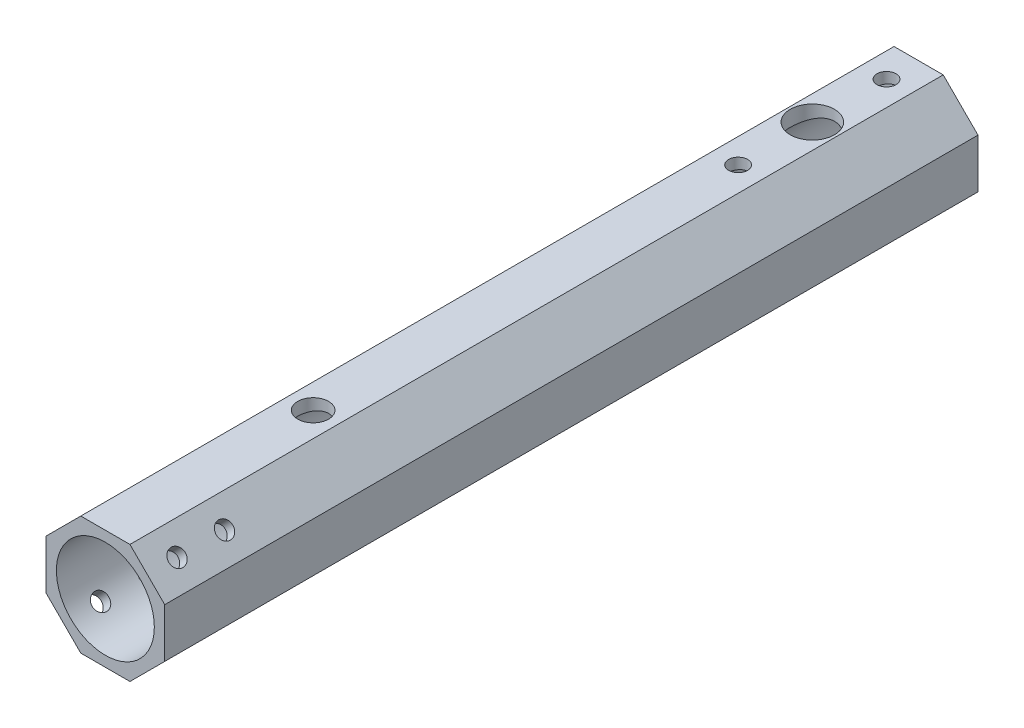
from build123d import *

# Parameters (mm, degrees)
SKETCH1_R               = 8.25
BOSS_EXTRUDE1_DEPTH     = 135
BOSS_EXTRUDE2_DEPTH     = 2
CUT_EXTRUDE1_DEPTH      = 138.727992797
CUT_EXTRUDE1_DEPTH_BACK = 138.727992797
SKETCH4_R               = 1.6
SKETCH4_R_2             = 2.6
SKETCH4_R_3             = 3.727922061
SKETCH6_R               = 1.4
CUT_EXTRUDE2_DEPTH      = 140.11090078
CIRPATTERN1_COUNT       = 2
CIRPATTERN1_ANGLE       = 270
SKETCH7_R               = 6.269832862
CUT_EXTRUDE3_DEPTH      = 138.727992904


with BuildPart() as part:
    # Sketch1 → Boss-Extrude1 (new body)
    with BuildSketch(Plane.XY):
        Polygon((10, 4.142135624), (4.142135624, 10), (-4.142135624, 10), (-10, 4.142135624), (-10, -4.142135624), (-4.142135624, -10), (4.142135624, -10), (10, -4.142135624), align=None)
        Circle(SKETCH1_R, mode=Mode.SUBTRACT)
    extrude(amount=-BOSS_EXTRUDE1_DEPTH)

    # Sketch2 → Boss-Extrude2 (add)
    with BuildSketch(Plane(origin=(0, 0, -135), x_dir=(-1, 0, 0), z_dir=(0, 0, -1))):
        Polygon((-10, 4.142135624), (-10, -4.142135624), (-4.142135624, -10), (4.142135624, -10), (10, -4.142135624), (10, 4.142135624), (4.142135624, 10), (-4.142135624, 10), align=None)
    extrude(amount=BOSS_EXTRUDE2_DEPTH)

    # Sketch4 → Cut-Extrude1 (cut, two sides: drawn at the far end of the back side and taken through both)
    with BuildSketch(Plane(origin=(0, 0, 0), x_dir=(1, 0, 0), z_dir=(0, 1, 0)).offset(-CUT_EXTRUDE1_DEPTH_BACK)):
        with Locations(Location((0, 131.593089119, 0), (0, 0, 270))):
            Circle(SKETCH4_R)
        with Locations(Location((0, 106.593089119, 0), (0, 0, 270))):
            Circle(SKETCH4_R)
        with Locations(Location((0, 35, 0), (0, 0, 270))):
            Circle(SKETCH4_R_2)
        with Locations(Location((0, 119.093089119, 0), (0, 0, 270))):
            Circle(SKETCH4_R_3)
    extrude(amount=CUT_EXTRUDE1_DEPTH + CUT_EXTRUDE1_DEPTH_BACK, mode=Mode.SUBTRACT)

    # Sketch6 → Cut-Extrude2 (cut, through all)
    with BuildSketch(Plane(origin=(-7.071067812, 7.071067812, 0), x_dir=(0, 0, 1), z_dir=(-0.7071067811865476, 0.7071067811865476, 0))):
        with Locations(Location((-13, 0, 0), (0, 0, 270))):
            Circle(SKETCH6_R)
        with Locations(Location((-5, 0, 0), (0, 0, 270))):
            Circle(SKETCH6_R)
    cut_extrude2 = extrude(amount=-CUT_EXTRUDE2_DEPTH, mode=Mode.SUBTRACT)

    # CirPattern1: Cut-Extrude2 ×2 about axis
    cirpattern1_axis = Axis((0, 0, 6.85), (0, 0, -1))
    for i in range(1, CIRPATTERN1_COUNT):
        add(cut_extrude2.rotate(cirpattern1_axis, i * CIRPATTERN1_ANGLE / (CIRPATTERN1_COUNT - 1)), mode=Mode.SUBTRACT)

    # Sketch7 → Cut-Extrude3 (cut, through all)
    with BuildSketch(Plane(origin=(0, 0, -137), x_dir=(-1, 0, 0), z_dir=(0, 0, -1))):
        Circle(SKETCH7_R)
    extrude(amount=-CUT_EXTRUDE3_DEPTH, mode=Mode.SUBTRACT)


solid = part.part
